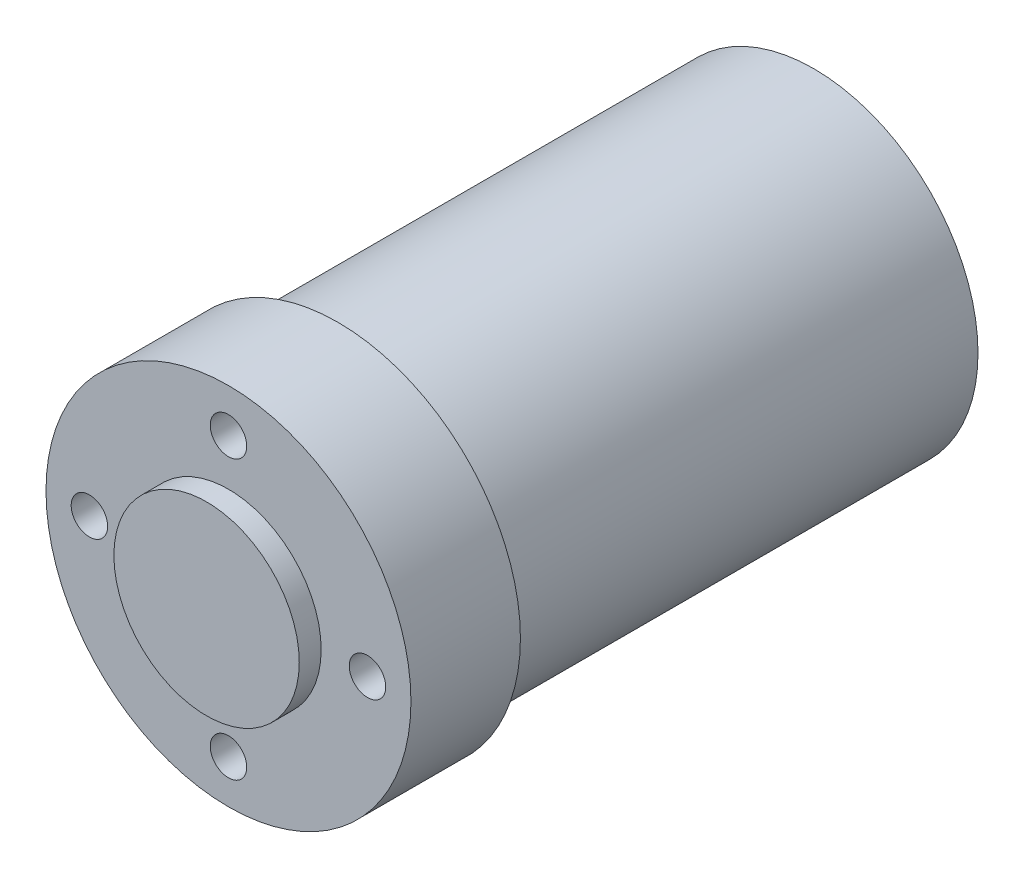
from build123d import *

# Parameters (mm, degrees)
SKETCH1_W                 = 25
SKETCH1_H                 = 15
SKETCH2_R                 = 12.7
BOSS_EXTRUDE1_DEPTH       = 3
SKETCH3_R                 = 22.4917
BOSS_EXTRUDE2_DEPTH       = 65.2
M6X1_0_TAPPED_HOLE1_D     = 5
M6X1_0_TAPPED_HOLE1_DEPTH = 10
M6X1_0_TAPPED_HOLE1_TIP   = 1.502151548
M6X1_0_TAPPED_HOLE2_D     = 5
M6X1_0_TAPPED_HOLE2_DEPTH = 15
M6X1_0_TAPPED_HOLE2_TIP   = 1.502151548


with BuildPart() as part:
    # Sketch1 → Revolve1 (revolve)
    with BuildSketch(Plane.XZ, mode=Mode.PRIVATE) as revolve1_sk:
        with Locations((12.5, 72.5)):
            Rectangle(SKETCH1_W, SKETCH1_H)
    revolve(revolve1_sk.sketch.rotate(Axis((0, 0, 80), (0, 0, -1)), 180), axis=Axis((0, 0, 80), (0, 0, -1)))

    # Sketch2 → Boss-Extrude1 (add)
    with BuildSketch(Plane.XY.offset(80)):
        Circle(SKETCH2_R)
    extrude(amount=BOSS_EXTRUDE1_DEPTH)

    # Sketch3 → Boss-Extrude2 (add)
    with BuildSketch(Plane(origin=(0, 0, 65), x_dir=(-1, 0, 0), z_dir=(0, 0, -1))):
        Circle(SKETCH3_R)
    extrude(amount=BOSS_EXTRUDE2_DEPTH)

    # M6x1.0 Tapped Hole1
    with Locations(Plane(origin=(0, 0, -0.2), x_dir=(-1, 0, 0), z_dir=(0, 0, -1))):
        with Locations((0, 17.5), (16.643489035, 5.407797402), (10.286241915, -14.157797402), (-10.286241915, -14.157797402), (-16.643489035, 5.407797402)):
            Hole(M6X1_0_TAPPED_HOLE1_D / 2, depth=M6X1_0_TAPPED_HOLE1_DEPTH)
            with Locations((0, 0, -(M6X1_0_TAPPED_HOLE1_DEPTH + M6X1_0_TAPPED_HOLE1_TIP / 2))):  # 118° drill point
                Cone(0, M6X1_0_TAPPED_HOLE1_D / 2, M6X1_0_TAPPED_HOLE1_TIP, mode=Mode.SUBTRACT)

    # M6x1.0 Tapped Hole2
    with Locations(Plane.XY.offset(80)):
        with Locations((-19.05, 0), (0, -19.05), (19.05, 0), (0, 19.05)):
            Hole(M6X1_0_TAPPED_HOLE2_D / 2, depth=M6X1_0_TAPPED_HOLE2_DEPTH)
            with Locations((0, 0, -(M6X1_0_TAPPED_HOLE2_DEPTH + M6X1_0_TAPPED_HOLE2_TIP / 2))):  # 118° drill point
                Cone(0, M6X1_0_TAPPED_HOLE2_D / 2, M6X1_0_TAPPED_HOLE2_TIP, mode=Mode.SUBTRACT)


solid = part.part
